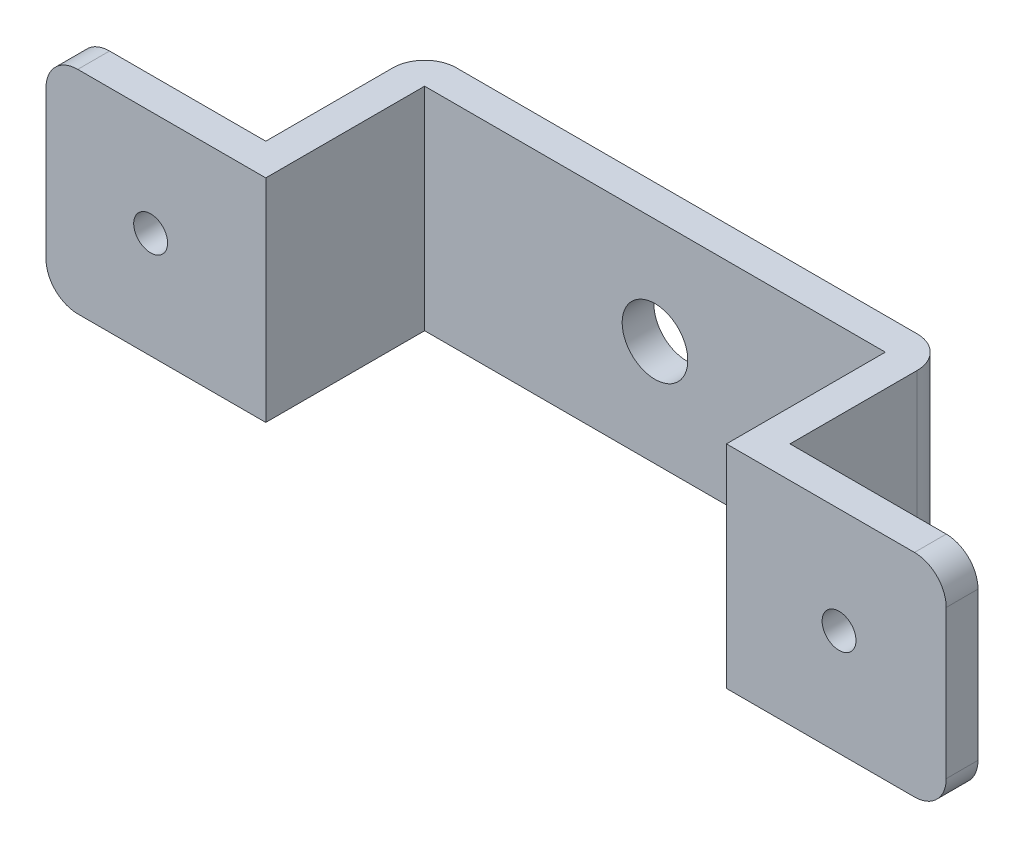
from build123d import *

# Parameters (mm, degrees)
SKETCH1_W           = 85
SKETCH1_H           = 20
BOSS_EXTRUDE1_DEPTH = 3
SKETCH2_W           = 3
SKETCH2_H           = 20
BOSS_EXTRUDE2_DEPTH = 12
SKETCH3_W           = 49.5
SKETCH3_H           = 20
BOSS_EXTRUDE3_DEPTH = 3
SKETCH4_W           = 43.5
SKETCH4_H           = 3
CUT_EXTRUDE1_DEPTH  = 50.307707308
SKETCH5_R           = 3.1
CUT_EXTRUDE2_DEPTH  = 48.22552276
SKETCH6_R           = 1.6
CUT_EXTRUDE3_DEPTH  = 48.22552276
FILLET1_R           = 3


with BuildPart() as part:
    # Sketch1 → Boss-Extrude1 (new body)
    with BuildSketch(Plane.XY):
        Rectangle(SKETCH1_W, SKETCH1_H)
    extrude(amount=BOSS_EXTRUDE1_DEPTH)

    # Sketch2 → Boss-Extrude2 (add)
    with BuildSketch(Plane(origin=(0, 0, 0), x_dir=(-1, 0, 0), z_dir=(0, 0, -1))):
        with Locations((-23.25, 0)):
            Rectangle(SKETCH2_W, SKETCH2_H)
        with Locations((23.25, 0)):
            Rectangle(SKETCH2_W, SKETCH2_H)
    extrude(amount=BOSS_EXTRUDE2_DEPTH)

    # Sketch3 → Boss-Extrude3 (add)
    with BuildSketch(Plane(origin=(0, 0, -12), x_dir=(-1, 0, 0), z_dir=(0, 0, -1))):
        Rectangle(SKETCH3_W, SKETCH3_H)
    extrude(amount=BOSS_EXTRUDE3_DEPTH)

    # Sketch4 → Cut-Extrude1 (cut, through all)
    with BuildSketch(Plane.XZ.offset(10)):
        with Locations((0, 1.5)):
            Rectangle(SKETCH4_W, SKETCH4_H)
    extrude(amount=-CUT_EXTRUDE1_DEPTH, mode=Mode.SUBTRACT)

    # Sketch5 → Cut-Extrude2 (cut, through all)
    with BuildSketch(Plane(origin=(0, 0, -15), x_dir=(-1, 0, 0), z_dir=(0, 0, -1))):
        Circle(SKETCH5_R)
    extrude(amount=-CUT_EXTRUDE2_DEPTH, mode=Mode.SUBTRACT)

    # Sketch6 → Cut-Extrude3 (cut, through all)
    with BuildSketch(Plane.XY.offset(3)):
        with Locations((32.380648159, 0.030992543)):
            Circle(SKETCH6_R)
        with Locations((-32.619351841, 0.030992543)):
            Circle(SKETCH6_R)
    extrude(amount=-CUT_EXTRUDE3_DEPTH, mode=Mode.SUBTRACT)

    # Fillet1
    fillet1_edges = [part.edges().sort_by_distance(p)[0] for p in [
        (24.75, 0, -15),
        (-24.75, 0, -15),
        (42.5, -10, 1.5),
        (-42.5, -10, 1.5),
        (-42.5, 10, 1.5),
        (42.5, 10, 1.5),
    ]]
    fillet(fillet1_edges, radius=FILLET1_R)


solid = part.part
